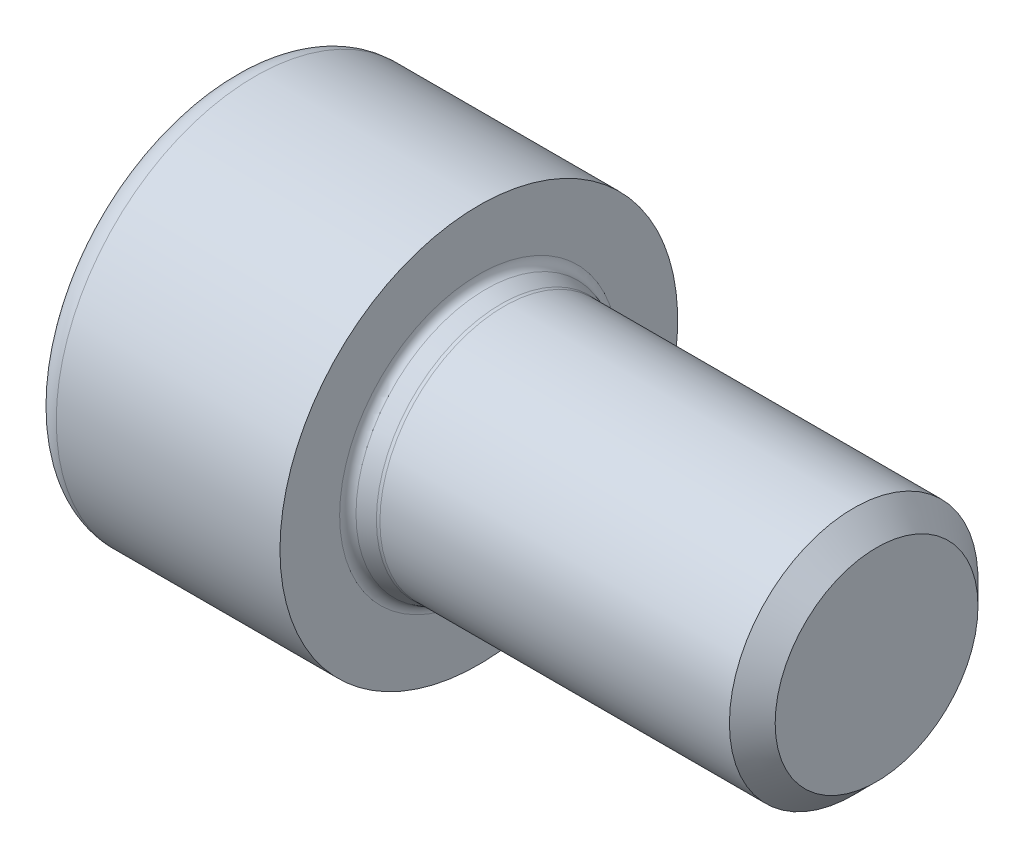
from build123d import *

# Parameters (mm, degrees)
CUT_EXTRUDE_1_DEPTH = 10
SKETCH_3_R          = 6
EXTRUDE_1_DEPTH     = 5


with BuildPart() as part:
    # 草图1 → 旋转1 (revolve)
    with BuildSketch(Plane.XY, mode=Mode.PRIVATE) as revolve_1_sk:
        with BuildLine():
            Line((-1.690598923, 0), (-4, 4))
            Line((-4, 4), (-10, 4))
            Line((-10, 4), (-10, 7))
            ThreePointArc((-10, 7), (-9.707106781, 7.707106781), (-9, 8))
            Line((-9, 8), (0, 8))
            Line((0, 8), (0, 5.6))
            ThreePointArc((0, 5.6), (0.076642269, 5.36454347), (0.277198888, 5.219316553))
            Line((0.277198888, 5.219316553), (0.897198888, 5.019316553))
            ThreePointArc((0.897198888, 5.019316553), (0.957844465, 5.004858646), (1.02, 5))
            Line((1.02, 5), (15.08, 5))
            Line((15.08, 5), (16, 4.08))
            Line((16, 4.08), (16, 0))
            Line((16, 0), (-1.690598923, 0))
        make_face()
    revolve(revolve_1_sk.sketch.rotate(Axis((16, 0, 0), (-1, 0, 0)), 270), axis=Axis((16, 0, 0), (-1, 0, 0)))

    # 草图2 → 切除-拉伸1 (cut)
    with BuildSketch(Plane(origin=(-4, 0, 0), x_dir=(0, 0, -1), z_dir=(1, 0, 0))):
        Polygon((-4, 2.309401077), (-4, -2.309401077), (0, -4.618802154), (4, -2.309401077), (4, 2.309401077), (0, 4.618802154), align=None)
    extrude(amount=-CUT_EXTRUDE_1_DEPTH, mode=Mode.SUBTRACT)


with BuildPart() as body_2:
    # 草图3 → 凸台-拉伸1 (new body)
    with BuildSketch(Plane(origin=(0, 0, 0), x_dir=(0, 0, -1), z_dir=(1, 0, 0))):
        Circle(SKETCH_3_R)
    extrude(amount=-EXTRUDE_1_DEPTH)

    # Delete Face 1: 1 face struck out; the rest of the skin is kept as a surface, the solid goes
    delete_face_1_1_drop = [body_2.part.faces().sort_by_distance(Vector(p))[0] for p in ((-5, 0, 0),)]
    delete_face_1_1 = Shell(body_2.part.faces() - delete_face_1_1_drop)


solid = part.part
